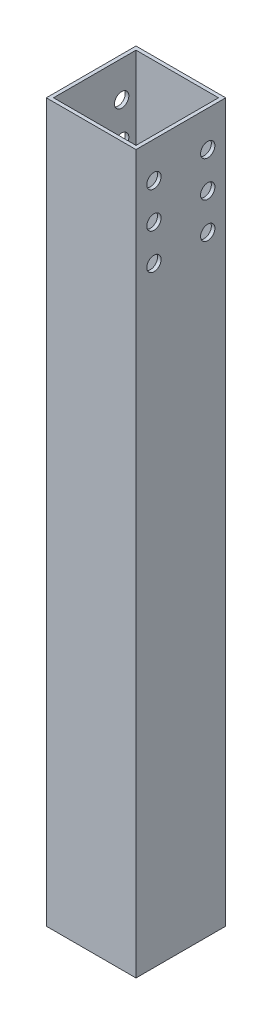
from build123d import *

# Parameters (mm, degrees)
SKETCH1_W           = 25
SKETCH1_H           = 25
SKETCH1_W_2         = 23
SKETCH1_H_2         = 23
BOSS_EXTRUDE1_DEPTH = 200
SKETCH3_R           = 2
CUT_EXTRUDE1_DEPTH  = 25


with BuildPart() as part:
    # Sketch1 → Boss-Extrude1 (new body)
    with BuildSketch(Plane(origin=(0, 0, 0), x_dir=(1, 0, 0), z_dir=(0, 1, 0))):
        Rectangle(SKETCH1_W, SKETCH1_H)
        Rectangle(SKETCH1_W_2, SKETCH1_H_2, mode=Mode.SUBTRACT)
    extrude(amount=BOSS_EXTRUDE1_DEPTH)

    # Sketch3 → Cut-Extrude1 (cut)
    with BuildSketch(Plane(origin=(12.5, 0, 0), x_dir=(0, 0, -1), z_dir=(1, 0, 0))):
        with Locations((7.5, 190)):
            Circle(SKETCH3_R)
        with Locations((7.5, 180)):
            Circle(SKETCH3_R)
        with Locations((-7.5, 190)):
            Circle(SKETCH3_R)
        with Locations((-7.5, 180)):
            Circle(SKETCH3_R)
        with Locations((7.5, 170)):
            Circle(SKETCH3_R)
        with Locations((-7.5, 170)):
            Circle(SKETCH3_R)
    extrude(amount=-CUT_EXTRUDE1_DEPTH, mode=Mode.SUBTRACT)


solid = part.part
